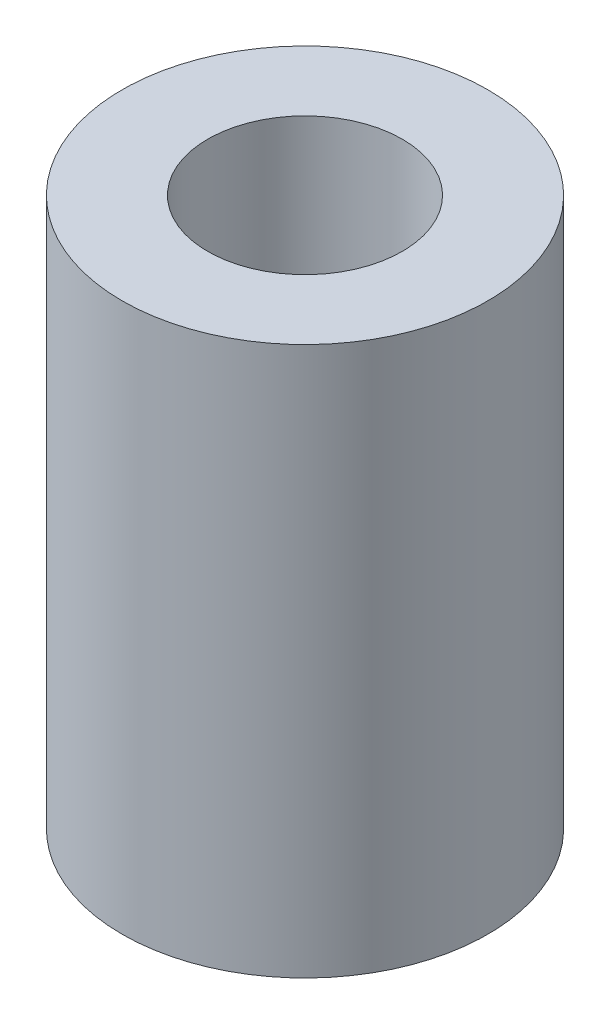
from build123d import *

# Parameters (mm, degrees)
SKETCH1_R      = 6.35
SKETCH1_R_2    = 3.3782
EXTRUDE1_DEPTH = 19.05


with BuildPart() as part:
    # Sketch1 → Extrude1 (new body)
    with BuildSketch(Plane(origin=(0, 0, 0), x_dir=(1, 0, 0), z_dir=(0, 1, 0))):
        with Locations(Location((0, 0, 0), (0, 0, 90))):
            Circle(SKETCH1_R)
        with Locations(Location((0, 0, 0), (0, 0, 90))):
            Circle(SKETCH1_R_2, mode=Mode.SUBTRACT)
    extrude(amount=EXTRUDE1_DEPTH)


solid = part.part
